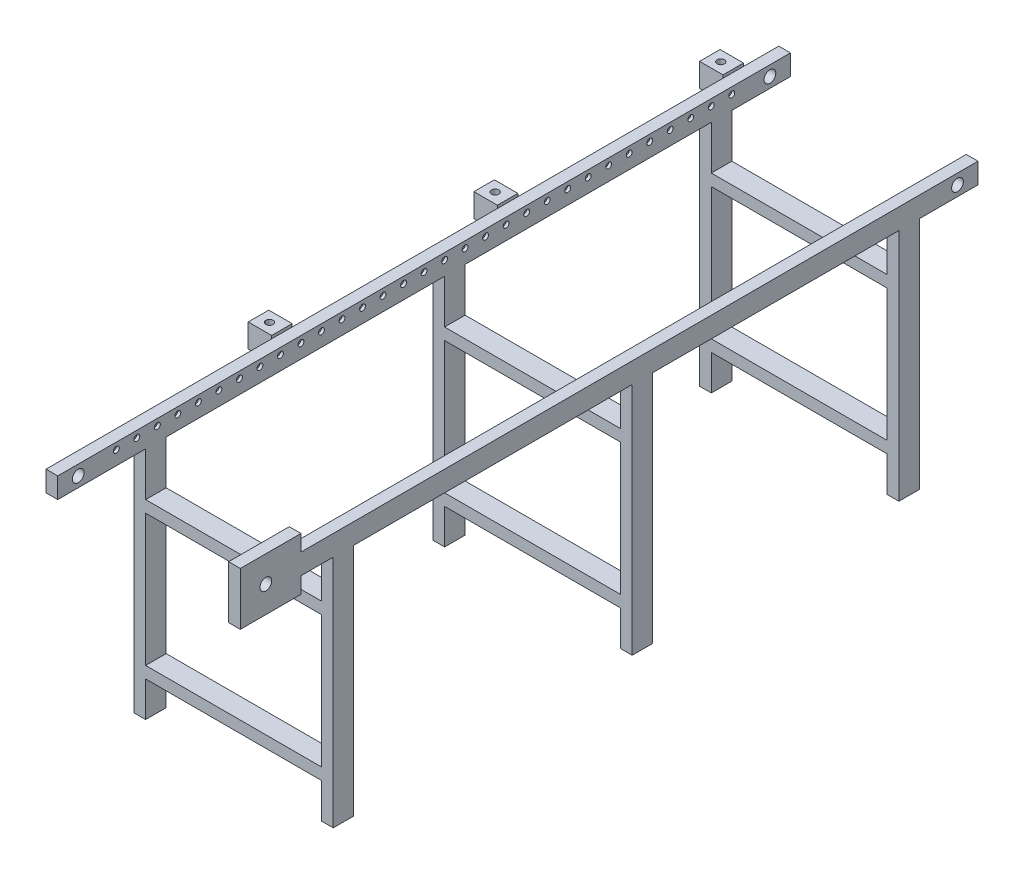
from build123d import *

# Parameters (mm, degrees)
SKETCH3_W           = 70
SKETCH3_H           = 800
SKETCH3_W_2         = 2500
SKETCH3_H_2         = 70
BOSS_EXTRUDE1_DEPTH = 40
SKETCH4_W           = 70
SKETCH4_H           = 40
BOSS_EXTRUDE2_DEPTH = 300
SKETCH5_R           = 10
CUT_EXTRUDE1_DEPTH  = 10
SKETCH6_R           = 20
CUT_EXTRUDE2_DEPTH  = 1634.806904135
SKETCH7_R           = 7.5
CUT_EXTRUDE3_DEPTH  = 20
SKETCH8_W           = 70
SKETCH8_H           = 80
BOSS_EXTRUDE3_DEPTH = 80
SKETCH10_R          = 12.5
CUT_EXTRUDE4_DEPTH  = 60
SKETCH11_W          = 240
SKETCH11_H          = 180
SKETCH11_R          = 20
BOSS_EXTRUDE4_DEPTH = 40
SKETCH12_W          = 33
SKETCH12_H          = 180
CUT_EXTRUDE5_DEPTH  = 1722.866719581


with BuildPart() as part:
    # Sketch3 → Boss-Extrude1 (new body)
    with BuildSketch(Plane(origin=(300, 0, 0), x_dir=(0, 0, -1), z_dir=(1, 0, 0))):
        with Locations((105, -435)):
            Rectangle(SKETCH3_W, SKETCH3_H)
        Rectangle(SKETCH3_W_2, SKETCH3_H_2)
        with Locations((-915, -435)):
            Rectangle(SKETCH3_W, SKETCH3_H)
        with Locations((1015, -435)):
            Rectangle(SKETCH3_W, SKETCH3_H)
    boss_extrude1 = extrude(amount=BOSS_EXTRUDE1_DEPTH)

    # Sketch4 → Boss-Extrude2 (add)
    with BuildSketch(Plane.ZY.offset(-300)):
        with Locations((-1015, -205)):
            Rectangle(SKETCH4_W, SKETCH4_H)
        with Locations((-105, -205)):
            Rectangle(SKETCH4_W, SKETCH4_H)
        with Locations((915, -205)):
            Rectangle(SKETCH4_W, SKETCH4_H)
        with Locations((-1015, -695)):
            Rectangle(SKETCH4_W, SKETCH4_H)
        with Locations((-105, -695)):
            Rectangle(SKETCH4_W, SKETCH4_H)
        with Locations((915, -695)):
            Rectangle(SKETCH4_W, SKETCH4_H)
    boss_extrude2 = extrude(amount=BOSS_EXTRUDE2_DEPTH)

    # Mirror2: Boss-Extrude2 across plane
    add(boss_extrude2.mirror(Plane(origin=(0, 0, 0), x_dir=(0, 0, 1), z_dir=(1, 0, 0))))

    # Mirror3: Boss-Extrude1 across plane
    add(boss_extrude1.mirror(Plane(origin=(0, 0, 0), x_dir=(0, 0, 1), z_dir=(1, 0, 0))))

    # Sketch5 → Cut-Extrude1 (cut)
    with BuildSketch(Plane(origin=(-300, 0, 0), x_dir=(0, 0, -1), z_dir=(1, 0, 0))):
        with Locations((-1050, 12.5)):
            Circle(SKETCH5_R)
        with Locations((-980, 12.5)):
            Circle(SKETCH5_R)
        with Locations((-910, 12.5)):
            Circle(SKETCH5_R)
        with Locations((-840, 12.5)):
            Circle(SKETCH5_R)
        with Locations((-770, 12.5)):
            Circle(SKETCH5_R)
        with Locations((-700, 12.5)):
            Circle(SKETCH5_R)
        with Locations((-630, 12.5)):
            Circle(SKETCH5_R)
        with Locations((-560, 12.5)):
            Circle(SKETCH5_R)
        with Locations((-490, 12.5)):
            Circle(SKETCH5_R)
        with Locations((-420, 12.5)):
            Circle(SKETCH5_R)
        with Locations((-350, 12.5)):
            Circle(SKETCH5_R)
        with Locations((-280, 12.5)):
            Circle(SKETCH5_R)
        with Locations((-210, 12.5)):
            Circle(SKETCH5_R)
        with Locations((-140, 12.5)):
            Circle(SKETCH5_R)
        with Locations((-70, 12.5)):
            Circle(SKETCH5_R)
        with Locations((0, 12.5)):
            Circle(SKETCH5_R)
        with Locations((70, 12.5)):
            Circle(SKETCH5_R)
        with Locations((140, 12.5)):
            Circle(SKETCH5_R)
        with Locations((210, 12.5)):
            Circle(SKETCH5_R)
        with Locations((280, 12.5)):
            Circle(SKETCH5_R)
        with Locations((350, 12.5)):
            Circle(SKETCH5_R)
        with Locations((420, 12.5)):
            Circle(SKETCH5_R)
        with Locations((490, 12.5)):
            Circle(SKETCH5_R)
        with Locations((560, 12.5)):
            Circle(SKETCH5_R)
        with Locations((630, 12.5)):
            Circle(SKETCH5_R)
        with Locations((700, 12.5)):
            Circle(SKETCH5_R)
        with Locations((770, 12.5)):
            Circle(SKETCH5_R)
        with Locations((840, 12.5)):
            Circle(SKETCH5_R)
        with Locations((910, 12.5)):
            Circle(SKETCH5_R)
        with Locations((980, 12.5)):
            Circle(SKETCH5_R)
        with Locations((1050, 12.5)):
            Circle(SKETCH5_R)
    cut_extrude1 = extrude(amount=-CUT_EXTRUDE1_DEPTH, mode=Mode.SUBTRACT)

    # Mirror4: Cut-Extrude1 across plane
    add(cut_extrude1.mirror(Plane(origin=(0, 0, 0), x_dir=(0, 0, 1), z_dir=(1, 0, 0))), mode=Mode.SUBTRACT)

    # Sketch6 → Cut-Extrude2 (cut, symmetric)
    with BuildSketch(Plane(origin=(-300, 0, 0), x_dir=(0, 0, -1), z_dir=(1, 0, 0))):
        with Locations((-1180, 0)):
            Circle(SKETCH6_R)
    cut_extrude2 = extrude(amount=CUT_EXTRUDE2_DEPTH, both=True, mode=Mode.SUBTRACT)

    # Sketch7 → Cut-Extrude3 (cut)
    with BuildSketch(Plane.XZ.offset(835)):
        with Locations(Location((-320, 915, 0), (0, 0, 270))):
            Circle(SKETCH7_R)
        with Locations(Location((320, 915, 0), (0, 0, 270))):
            Circle(SKETCH7_R)
        with Locations(Location((320, -105, 0), (0, 0, 270))):
            Circle(SKETCH7_R)
        with Locations(Location((-320, -105, 0), (0, 0, 270))):
            Circle(SKETCH7_R)
        with Locations(Location((320, -1015, 0), (0, 0, 270))):
            Circle(SKETCH7_R)
        with Locations(Location((-320, -1015, 0), (0, 0, 270))):
            Circle(SKETCH7_R)
    extrude(amount=-CUT_EXTRUDE3_DEPTH, mode=Mode.SUBTRACT)

    # Mirror5: Cut-Extrude2 across plane
    add(cut_extrude2.mirror(Plane.XY), mode=Mode.SUBTRACT)

    # Sketch8 → Boss-Extrude3 (add)
    with BuildSketch(Plane.ZY.offset(340)):
        with Locations((-325, 5)):
            Rectangle(SKETCH8_W, SKETCH8_H)
        with Locations((445, 5)):
            Rectangle(SKETCH8_W, SKETCH8_H)
        with Locations((-1095, 5)):
            Rectangle(SKETCH8_W, SKETCH8_H)
    extrude(amount=BOSS_EXTRUDE3_DEPTH)

    # Sketch10 → Cut-Extrude4 (cut)
    with BuildSketch(Plane(origin=(0, 45, 0), x_dir=(1, 0, 0), z_dir=(0, 1, 0))):
        with Locations(Location((-382.500751055, 1095, 0), (0, 0, 270))):
            Circle(SKETCH10_R)
        with Locations(Location((-382.500751055, 325, 0), (0, 0, 270))):
            Circle(SKETCH10_R)
        with Locations(Location((-382.500751055, -445, 0), (0, 0, 270))):
            Circle(SKETCH10_R)
    extrude(amount=-CUT_EXTRUDE4_DEPTH, mode=Mode.SUBTRACT)

    # Sketch11 → Boss-Extrude4 (add)
    with BuildSketch(Plane(origin=(340, 0, 0), x_dir=(0, 0, -1), z_dir=(1, 0, 0))):
        with Locations((-1180, 0)):
            Rectangle(SKETCH11_W, SKETCH11_H)
        with Locations((-1180, 0)):
            Circle(SKETCH11_R, mode=Mode.SUBTRACT)
    extrude(amount=-BOSS_EXTRUDE4_DEPTH)

    # Sketch12 → Cut-Extrude5 (cut, through all)
    with BuildSketch(Plane(origin=(340, 0, 0), x_dir=(0, 0, -1), z_dir=(1, 0, 0))):
        with Locations((-1283.5, 0)):
            Rectangle(SKETCH12_W, SKETCH12_H)
    extrude(amount=-CUT_EXTRUDE5_DEPTH, mode=Mode.SUBTRACT)


solid = part.part
